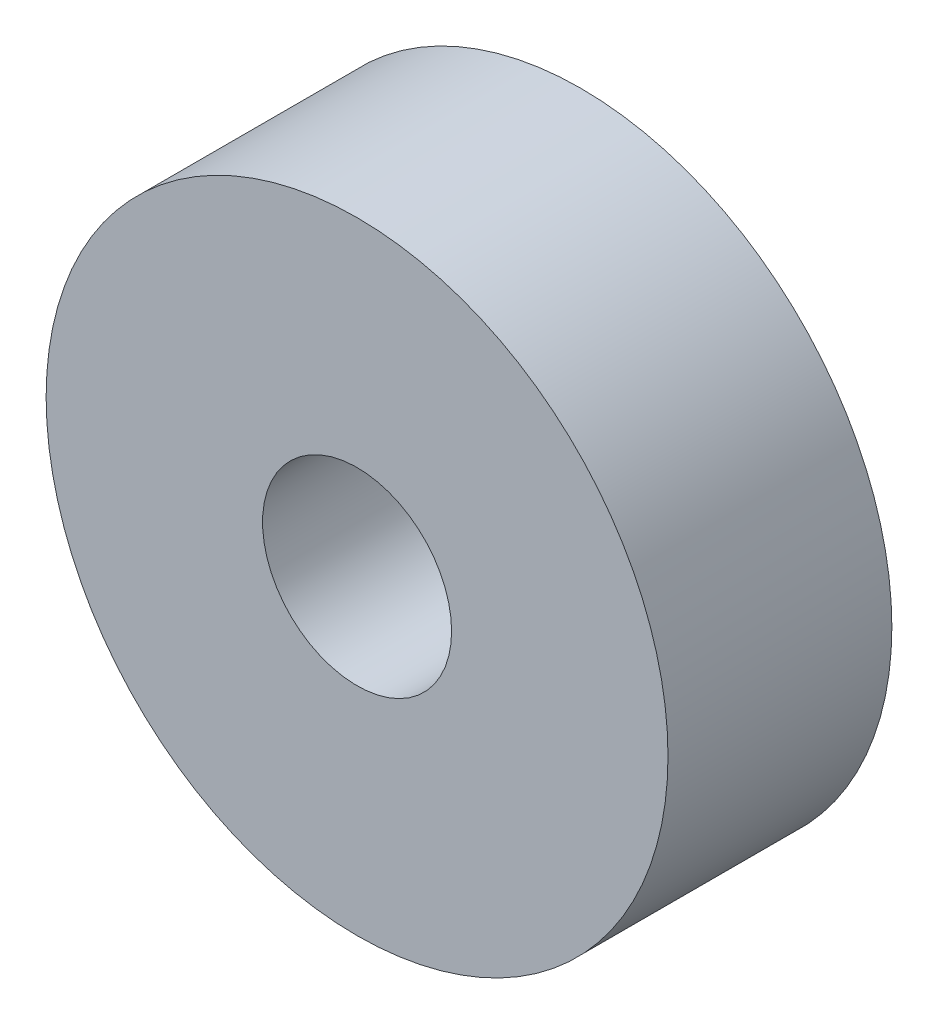
from build123d import *

# Parameters (mm, degrees)
SKETCH_1_R   = 12.5
SLEEVE_DEPTH = 9
SKETCH_2_R   = 3.8
BORE_DEPTH   = 20.836834425


with BuildPart() as part:
    # 草图1 → Sleeve (new body)
    with BuildSketch(Plane.XY):
        Circle(SKETCH_1_R)
    extrude(amount=SLEEVE_DEPTH)

    # 草图2 → Bore (cut, through all)
    with BuildSketch(Plane.XY.offset(9)):
        Circle(SKETCH_2_R)
    extrude(amount=-BORE_DEPTH, mode=Mode.SUBTRACT)


solid = part.part
